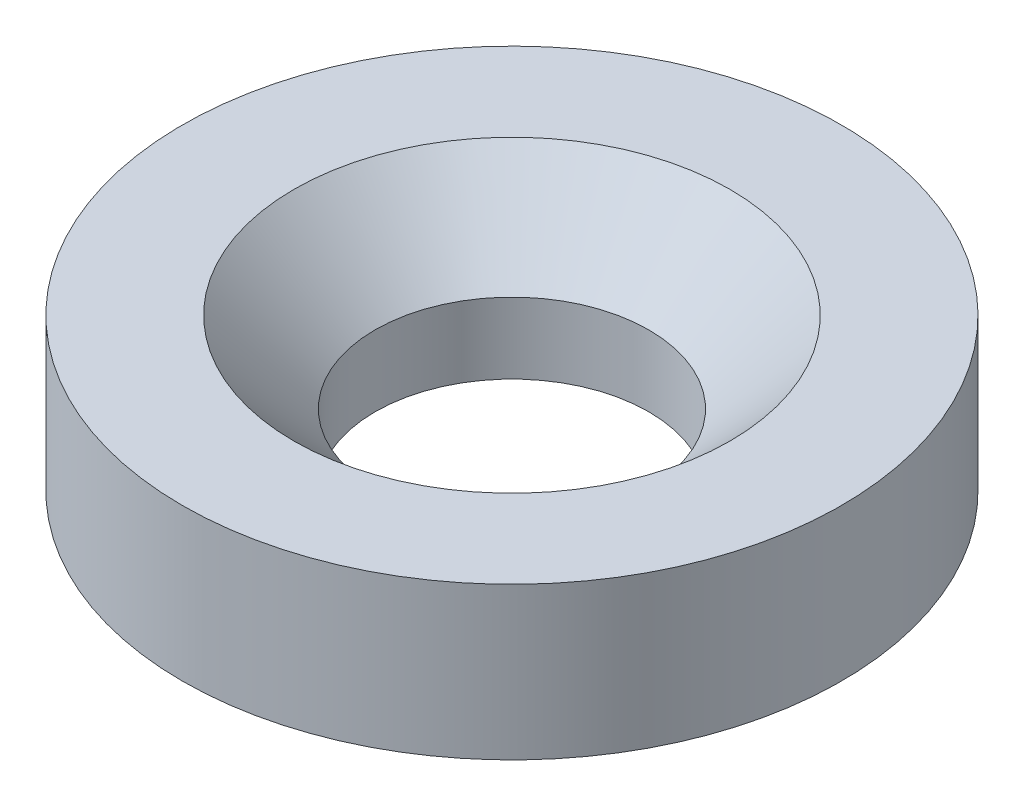
from build123d import *

# Parameters (mm, degrees)
SKETCH_1_R          = 3.25
EXTRUDE_1_DEPTH     = 1.5
SKETCH_2_R          = 1.35
CUT_EXTRUDE_1_DEPTH = 2
CHAMFER_1_SIZE      = 0.8


with BuildPart() as part:
    # 스케치1 → 보스-돌출1 (new body)
    with BuildSketch(Plane(origin=(0, 0, 0), x_dir=(1, 0, 0), z_dir=(0, 1, 0))):
        with Locations(Location((0, 0, 0), (0, 0, 270))):
            Circle(SKETCH_1_R)
    extrude(amount=EXTRUDE_1_DEPTH)

    # 스케치2 → 컷-돌출1 (cut)
    with BuildSketch(Plane(origin=(0, 1.5, 0), x_dir=(1, 0, 0), z_dir=(0, 1, 0))):
        with Locations(Location((0, 0, 0), (0, 0, 270))):
            Circle(SKETCH_2_R)
    extrude(amount=-CUT_EXTRUDE_1_DEPTH, mode=Mode.SUBTRACT)

    # 모따기1
    chamfer_1_edges = [part.edges().sort_by_distance(p)[0] for p in [
        (0, 1.5, -1.35),
    ]]
    chamfer(chamfer_1_edges, length=CHAMFER_1_SIZE)


solid = part.part
